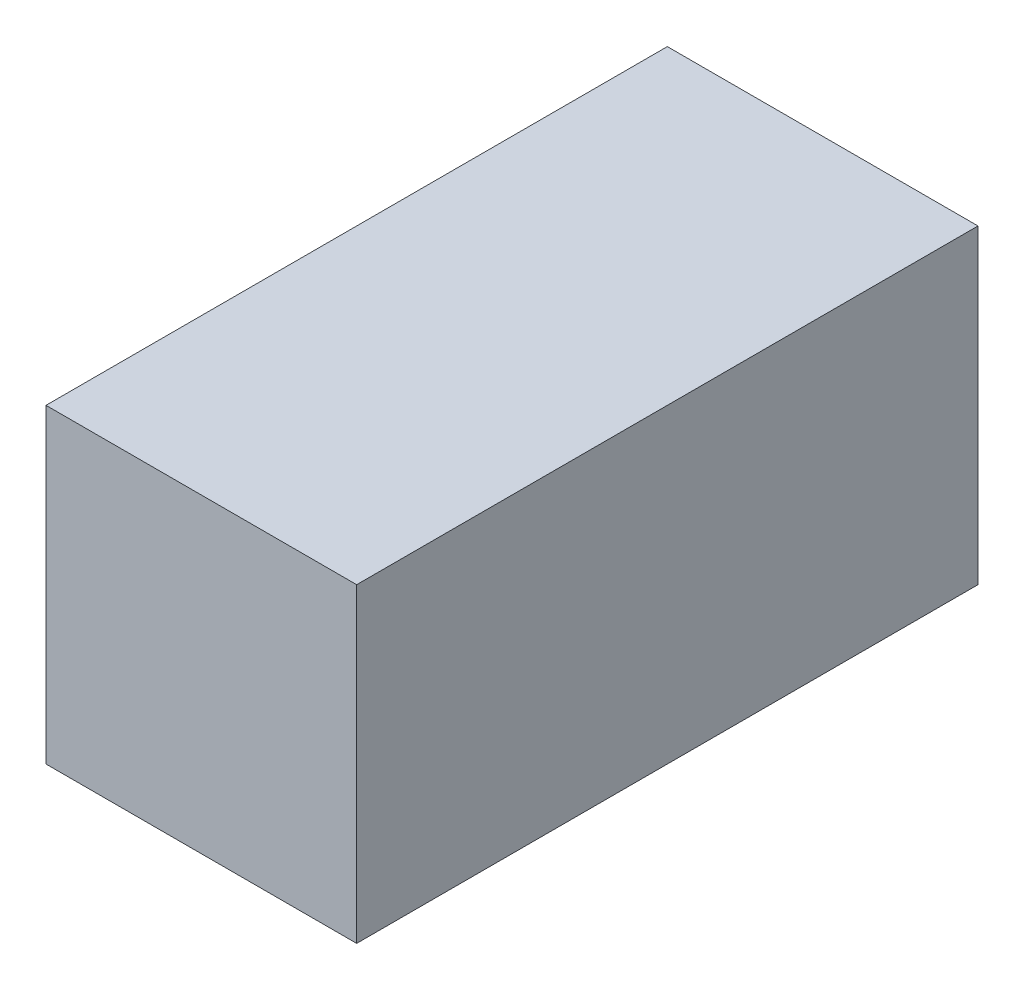
from build123d import *

# Parameters (mm, degrees)
SELECTIONSEED_W        = 5
SELECTIONSEED_H        = 5
SELECTIONEXTRUDE_DEPTH = 10


with BuildPart() as part:
    # SelectionSeed → SelectionExtrude (new body)
    with BuildSketch(Plane.XY):
        with Locations((7.5, 7.5)):
            Rectangle(SELECTIONSEED_W, SELECTIONSEED_H)
    extrude(amount=SELECTIONEXTRUDE_DEPTH)


solid = part.part
